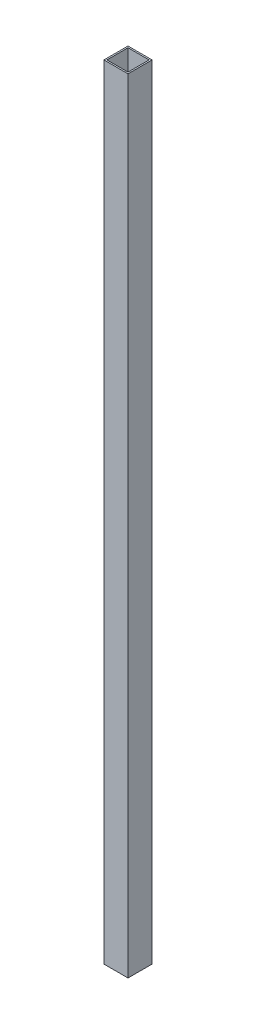
from build123d import *

# Parameters (mm, degrees)
SKETCH1_W           = 25.4
SKETCH1_H           = 25.4
SKETCH1_W_2         = 22.225
SKETCH1_H_2         = 22.225
BOSS_EXTRUDE1_DEPTH = 825.5


with BuildPart() as part:
    # Sketch1 → Boss-Extrude1 (new body)
    with BuildSketch(Plane(origin=(0, 0, 0), x_dir=(1, 0, 0), z_dir=(0, 1, 0))):
        Rectangle(SKETCH1_W, SKETCH1_H)
        Rectangle(SKETCH1_W_2, SKETCH1_H_2, mode=Mode.SUBTRACT)
    extrude(amount=BOSS_EXTRUDE1_DEPTH)


solid = part.part
